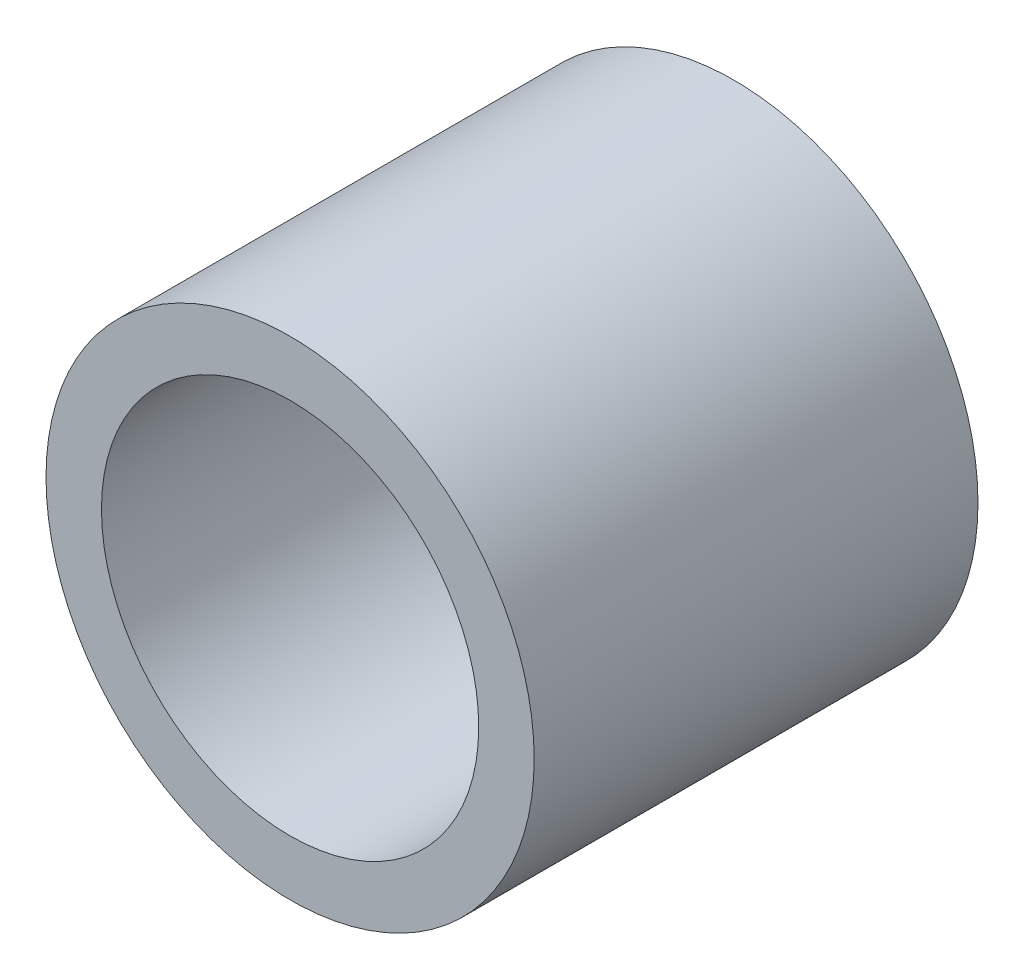
from build123d import *

# Parameters (mm, degrees)
SKETCH1_R           = 22
SKETCH1_R_2         = 17
BOSS_EXTRUDE1_DEPTH = 40


with BuildPart() as part:
    # Sketch1 → Boss-Extrude1 (new body)
    with BuildSketch(Plane.XY):
        Circle(SKETCH1_R)
        Circle(SKETCH1_R_2, mode=Mode.SUBTRACT)
    extrude(amount=BOSS_EXTRUDE1_DEPTH)


solid = part.part
